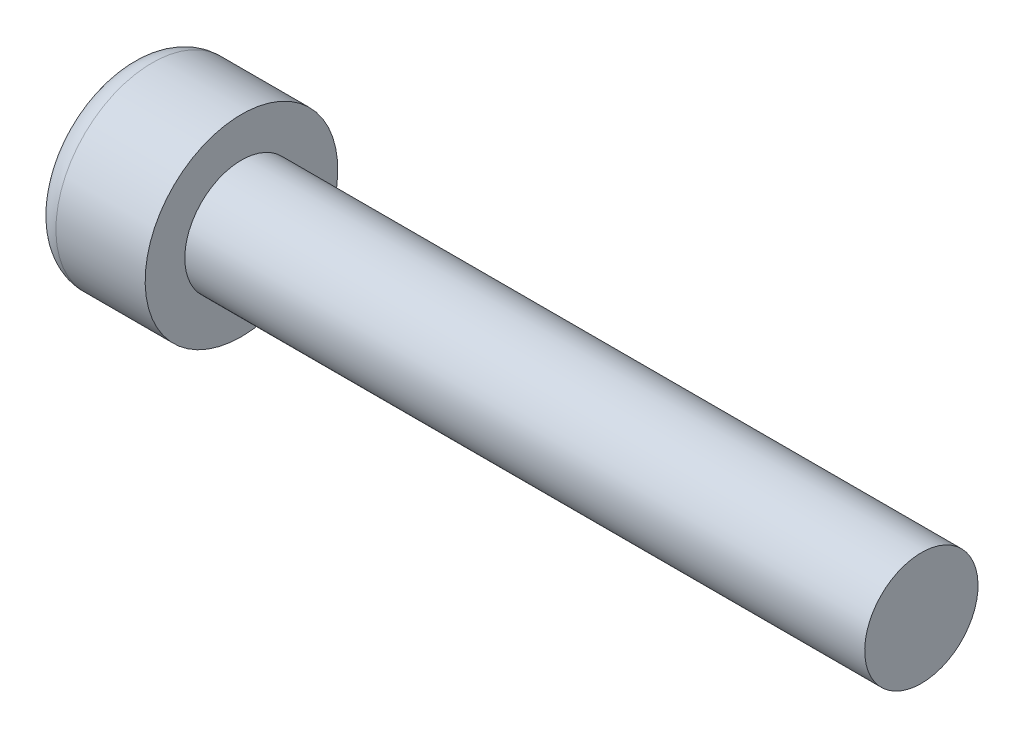
from build123d import *

# Parameters (mm, degrees)
CUT_EXTRUDE1_DEPTH = 2.5


with BuildPart() as part:
    # Sketch1 → Revolve1 (revolve)
    with BuildSketch(Plane.XY, mode=Mode.PRIVATE) as revolve1_sk:
        with BuildLine():
            Line((0, 0), (0, 3.1875))
            ThreePointArc((0, 3.1875), (0.311199045, 3.938800955), (1.0625, 4.25))
            Line((1.0625, 4.25), (5, 4.25))
            Line((5, 4.25), (5, 2.5))
            Line((5, 2.5), (35, 2.5))
            Line((35, 2.5), (35, 0))
            Line((35, 0), (0, 0))
        make_face()
    revolve(revolve1_sk.sketch.rotate(Axis((0, 0, 0), (1, 0, 0)), 180), axis=Axis((0, 0, 0), (1, 0, 0)))

    # Sketch2 → Cut-Extrude1 (cut)
    with BuildSketch(Plane.ZY):
        Polygon((0, 2.309401077), (-2, 1.154700538), (-2, -1.154700538), (0, -2.309401077), (2, -1.154700538), (2, 1.154700538), align=None)
    extrude(amount=-CUT_EXTRUDE1_DEPTH, mode=Mode.SUBTRACT)


solid = part.part
